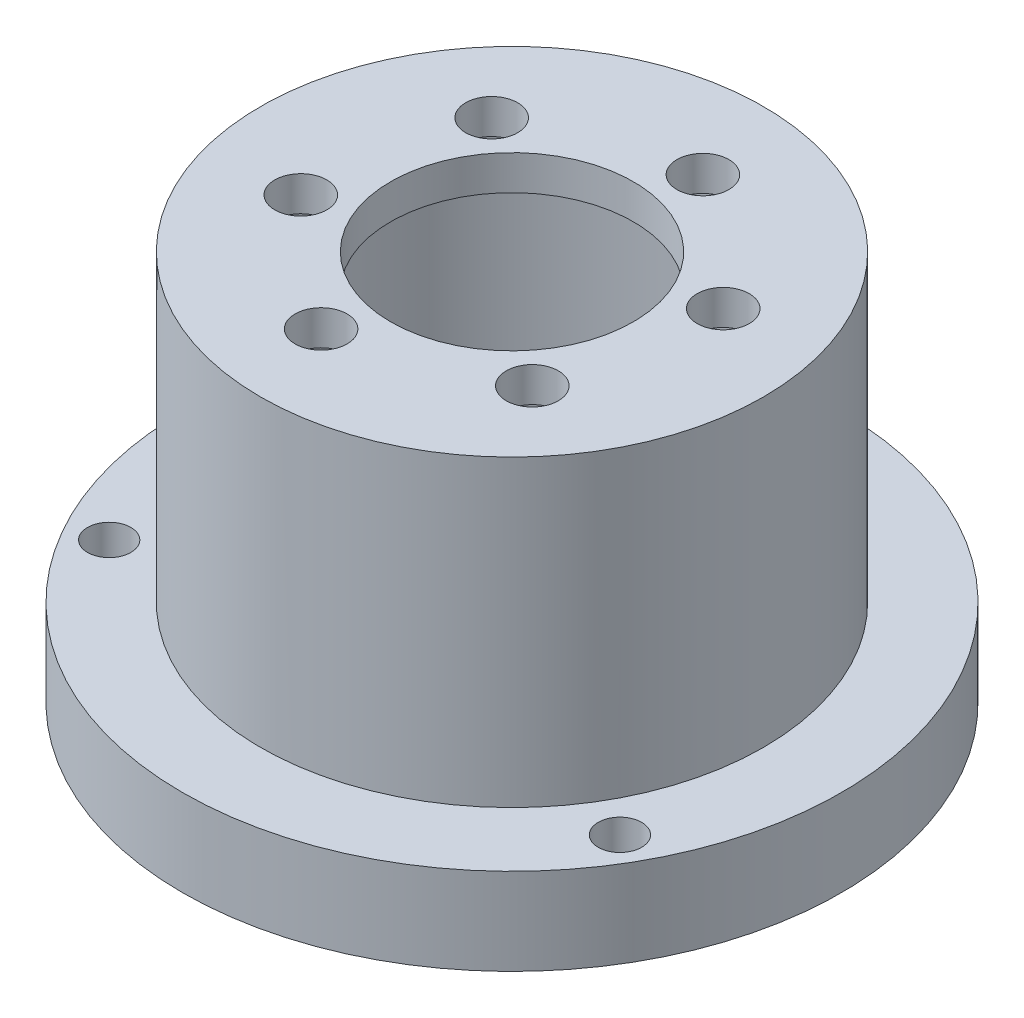
from build123d import *

# Parameters (mm, degrees)
SKETCH_1_R        = 19
SKETCH_1_R_2      = 13
SKETCH_1_R_3      = 1.25
EXTRUDE_1_DEPTH   = 5
SKETCH_2_R        = 14.5
SKETCH_2_R_2      = 13
EXTRUDE_1_2_DEPTH = 15.5
SKETCH_3_R        = 14.5
SKETCH_3_R_2      = 13
SKETCH_3_R_3      = 7
SKETCH_3_R_4      = 1.5
EXTRUDE_2_DEPTH   = 2


with BuildPart() as part:
    # 草图1 → Extrude 1 (new body)
    with BuildSketch(Plane(origin=(0, 0, 0), x_dir=(1, 0, 0), z_dir=(0, 1, 0))):
        with Locations(Location((0, 0, 0), (0, 0, 270))):
            Circle(SKETCH_1_R)
        with Locations(Location((0, 0, 0), (0, 0, 270))):
            Circle(SKETCH_1_R_2, mode=Mode.SUBTRACT)
        with Locations(Location((0, 17, 0), (0, 0, 270))):
            Circle(SKETCH_1_R_3, mode=Mode.SUBTRACT)
        with Locations(Location((14.722431864, -8.5, 0), (0, 0, 270))):
            Circle(SKETCH_1_R_3, mode=Mode.SUBTRACT)
        with Locations(Location((-14.722431864, -8.5, 0), (0, 0, 270))):
            Circle(SKETCH_1_R_3, mode=Mode.SUBTRACT)
    extrude(amount=EXTRUDE_1_DEPTH)

    # 草图2 → Extrude 1 2 (add)
    with BuildSketch(Plane(origin=(0, 5, 0), x_dir=(1, 0, 0), z_dir=(0, 1, 0))):
        Circle(SKETCH_2_R)
        Circle(SKETCH_2_R_2, mode=Mode.SUBTRACT)
    extrude(amount=EXTRUDE_1_2_DEPTH)

    # 草图3 → 凸台-拉伸2 (add)
    # profile 1 of 2: a face of its own
    with BuildSketch(Plane(origin=(0, 20.5, 0), x_dir=(1, 0, 0), z_dir=(0, 1, 0))):
        Circle(SKETCH_3_R)
        with Locations(Location((0, 0, 0), (0, 0, 270))):
            Circle(SKETCH_3_R_2, mode=Mode.SUBTRACT)
    # profile 2 of 2: a face of its own
    with BuildSketch(Plane(origin=(0, 20.5, 0), x_dir=(1, 0, 0), z_dir=(0, 1, 0))):
        with Locations(Location((0, 0, 0), (0, 0, 270))):
            Circle(SKETCH_3_R_2)
        with Locations(Location((0, 0, 0), (0, 0, 270))):
            Circle(SKETCH_3_R_3, mode=Mode.SUBTRACT)
        with Locations(Location((-7.27742221, 6.106482292, 0), (0, 0, 270))):
            Circle(SKETCH_3_R_4, mode=Mode.SUBTRACT)
        with Locations(Location((-8.927079897, -3.249191362, 0), (0, 0, 270))):
            Circle(SKETCH_3_R_4, mode=Mode.SUBTRACT)
        with Locations(Location((-1.649657688, -9.355673654, 0), (0, 0, 270))):
            Circle(SKETCH_3_R_4, mode=Mode.SUBTRACT)
        with Locations(Location((7.27742221, -6.106482292, 0), (0, 0, 270))):
            Circle(SKETCH_3_R_4, mode=Mode.SUBTRACT)
        with Locations(Location((8.927079897, 3.249191362, 0), (0, 0, 270))):
            Circle(SKETCH_3_R_4, mode=Mode.SUBTRACT)
        with Locations(Location((1.649657688, 9.355673654, 0), (0, 0, 270))):
            Circle(SKETCH_3_R_4, mode=Mode.SUBTRACT)
    extrude(amount=EXTRUDE_2_DEPTH)


solid = part.part
